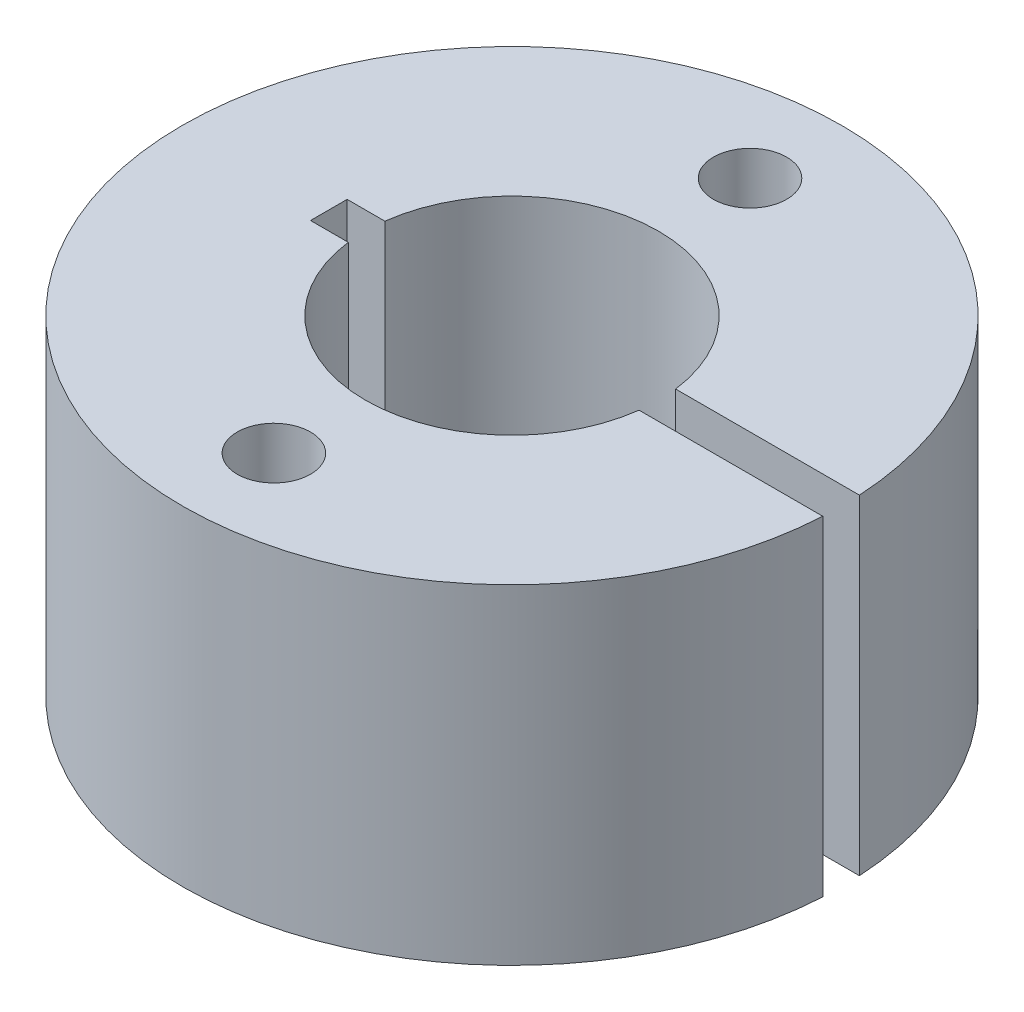
from build123d import *

# Parameters (mm, degrees)
BOSS_EXTRU_1_DEPTH      = 9
ESQUISSE2_R             = 1
ENL_V_MAT_EXTRU_1_DEPTH = 16.588457268


with BuildPart() as part:
    # Esquisse1 → Boss.-Extru.1 (new body)
    with BuildSketch(Plane(origin=(0, 0, 0), x_dir=(1, 0, 0), z_dir=(0, 1, 0))):
        with BuildLine():
            Line((3.968626967, 0.5), (8.986100378, 0.5))
            ThreePointArc((8.986100378, 0.5), (-9, 0), (8.986100378, -0.5))
            Line((8.986100378, -0.5), (3.968626967, -0.5))
            ThreePointArc((3.968626967, -0.5), (0, -4), (-3.968626967, -0.5))
            Line((-3.968626967, -0.5), (-5, -0.5))
            Line((-5, -0.5), (-5, 0.5))
            Line((-5, 0.5), (-3.968626967, 0.5))
            ThreePointArc((-3.968626967, 0.5), (0, 4), (3.968626967, 0.5))
        make_face()
    extrude(amount=BOSS_EXTRU_1_DEPTH)

    # Esquisse2 → Enlèv. mat.-Extru.1 (cut, through all)
    with BuildSketch(Plane(origin=(0, 9, 0), x_dir=(1, 0, 0), z_dir=(0, 1, 0))):
        with Locations(Location((0, -6.5, 0), (0, 0, 270))):
            Circle(ESQUISSE2_R)
        with Locations(Location((0, 6.5, 0), (0, 0, 270))):
            Circle(ESQUISSE2_R)
    extrude(amount=-ENL_V_MAT_EXTRU_1_DEPTH, mode=Mode.SUBTRACT)


solid = part.part
